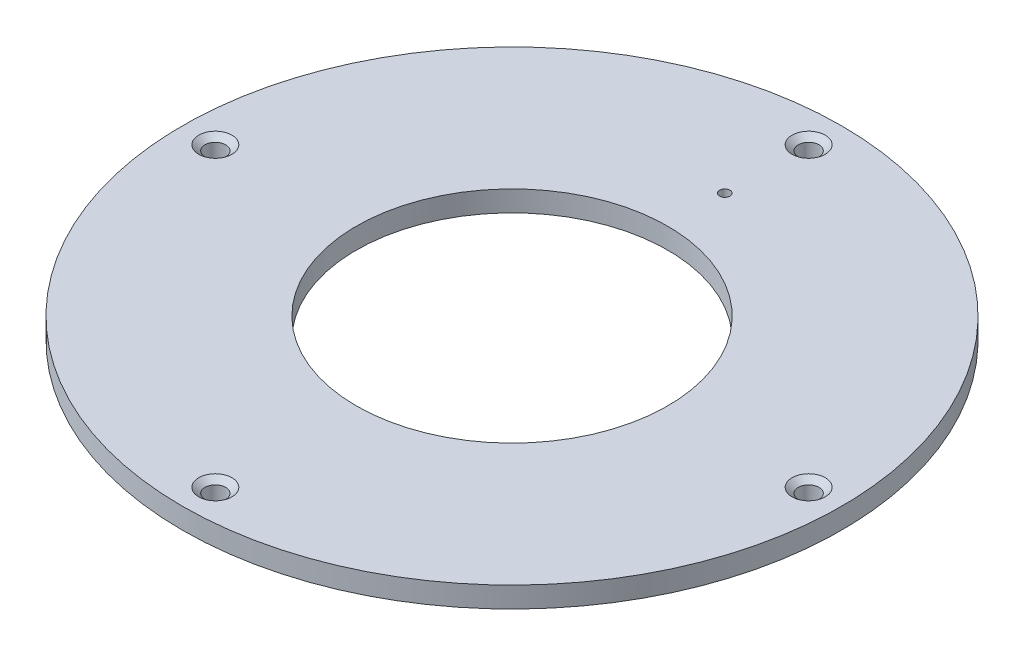
from build123d import *

# Parameters (mm, degrees)
SKETCH1_R                                       = 15.875
BOSS_EXTRUDE1_DEPTH                             = 1
CUT_EXTRUDE1_DEPTH                              = 23.472900347
CUT_EXTRUDE1_DEPTH_BACK                         = 23.472900347
SKETCH2_R                                       = 7.5
CUT_EXTRUDE2_DEPTH                              = 23.472900347
CUT_EXTRUDE2_DEPTH_BACK                         = 23.472900347
SKETCH4_R                                       = 0.25
CSK_FOR_M2_FLAT_HEAD_MACHINE_SCREW1_D           = 1
CSK_FOR_M2_FLAT_HEAD_MACHINE_SCREW1_CSINK_D     = 1.6
CSK_FOR_M2_FLAT_HEAD_MACHINE_SCREW1_CSINK_ANGLE = 100


with BuildPart() as part:
    # Sketch1 → Boss-Extrude1 (new body)
    with BuildSketch(Plane(origin=(0, 0, 0), x_dir=(1, 0, 0), z_dir=(0, 1, 0))):
        with Locations(Location((0, 0, 0), (0, 0, 270))):
            Circle(SKETCH1_R)
    extrude(amount=BOSS_EXTRUDE1_DEPTH)

    # Sketch2 → Cut-Extrude1 (cut, two sides: drawn at the far end of the back side and taken through both)
    with BuildSketch(Plane(origin=(0, 1, 0), x_dir=(1, 0, 0), z_dir=(0, 1, 0)).offset(-CUT_EXTRUDE1_DEPTH_BACK)):
        with Locations(Location((0, 0, 0), (0, 0, 270))):
            Circle(SKETCH2_R)
    extrude(amount=CUT_EXTRUDE1_DEPTH + CUT_EXTRUDE1_DEPTH_BACK, mode=Mode.SUBTRACT)

    # Sketch4 → Cut-Extrude2 (cut, two sides: drawn at the far end of the back side and taken through both)
    with BuildSketch(Plane(origin=(0, 1, 0), x_dir=(1, 0, 0), z_dir=(0, 1, 0)).offset(-CUT_EXTRUDE2_DEPTH_BACK)):
        with Locations(Location((0, 10.25, 0), (0, 0, 270))):
            Circle(SKETCH4_R)
    extrude(amount=CUT_EXTRUDE2_DEPTH + CUT_EXTRUDE2_DEPTH_BACK, mode=Mode.SUBTRACT)

    # CSK for M2 Flat Head Machine Screw1 (through all)
    with Locations(Plane(origin=(0, 1, 0), x_dir=(1, 0, 0), z_dir=(0, 1, 0))):
        with Locations((0, 14.29), (14.29, 0), (0, -14.29), (-14.29, 0)):
            CounterSinkHole(CSK_FOR_M2_FLAT_HEAD_MACHINE_SCREW1_D / 2, CSK_FOR_M2_FLAT_HEAD_MACHINE_SCREW1_CSINK_D / 2, counter_sink_angle=CSK_FOR_M2_FLAT_HEAD_MACHINE_SCREW1_CSINK_ANGLE)


solid = part.part
